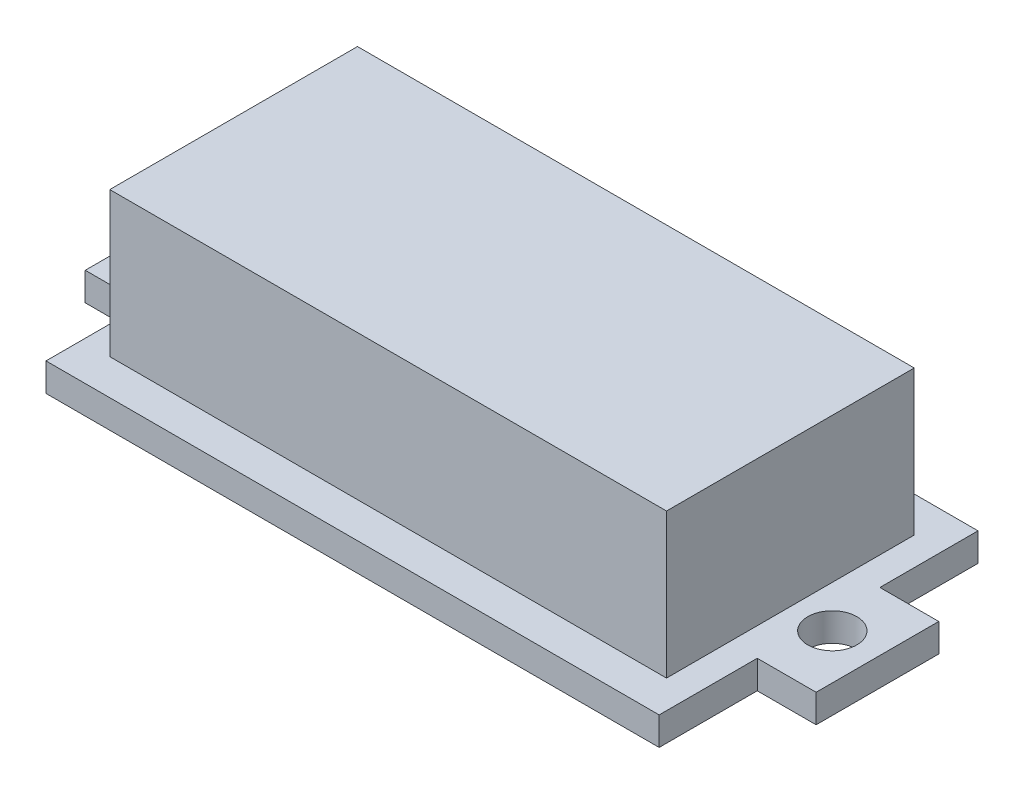
from build123d import *

# Parameters (mm, degrees)
SKETCH1_R                = 1
BOSS_EXTRUDE1_DEPTH      = 1.15
SKETCH2_W                = 22.7
SKETCH2_H                = 10.1
BOSS_EXTRUDE2_DEPTH      = 5.9
BOSS_EXTRUDE3_DEPTH      = 2
BOSS_EXTRUDE3_DEPTH_BACK = 0.5
SKETCH3_R                = 0.68


with BuildPart() as part:
    # Sketch1 → Boss-Extrude1 (new body)
    with BuildSketch(Plane(origin=(0, 0, 0), x_dir=(1, 0, 0), z_dir=(0, 1, 0))):
        Polygon((-12.5, 6.5), (12.5, 6.5), (12.5, 2.5), (14.9, 2.5), (14.9, -2.5), (12.5, -2.5), (12.5, -6.5), (-12.5, -6.5), (-12.5, -2.5), (-14.9, -2.5), (-14.9, 2.5), (-12.5, 2.5), align=None)
        with Locations(Location((13.06, 0, 0), (0, 0, 270))):
            Circle(SKETCH1_R, mode=Mode.SUBTRACT)
        with Locations(Location((-13.06, 0, 0), (0, 0, 270))):
            Circle(SKETCH1_R, mode=Mode.SUBTRACT)
    extrude(amount=BOSS_EXTRUDE1_DEPTH)

    # Sketch2 → Boss-Extrude2 (add)
    with BuildSketch(Plane(origin=(0, 1.15, 0), x_dir=(1, 0, 0), z_dir=(0, 1, 0))):
        Rectangle(SKETCH2_W, SKETCH2_H)
    extrude(amount=BOSS_EXTRUDE2_DEPTH)

    # Sketch3 → Boss-Extrude3 (add, two sides: drawn at the far end of the back side and taken through both)
    with BuildSketch(Plane(origin=(0, 0, -6.5), x_dir=(-1, 0, 0), z_dir=(0, 0, -1)).offset(-BOSS_EXTRUDE3_DEPTH_BACK)):
        with Locations((8.85, 0)):
            Circle(SKETCH3_R)
        with Locations((6.35, 0)):
            Circle(SKETCH3_R)
    extrude(amount=BOSS_EXTRUDE3_DEPTH + BOSS_EXTRUDE3_DEPTH_BACK)


solid = part.part
